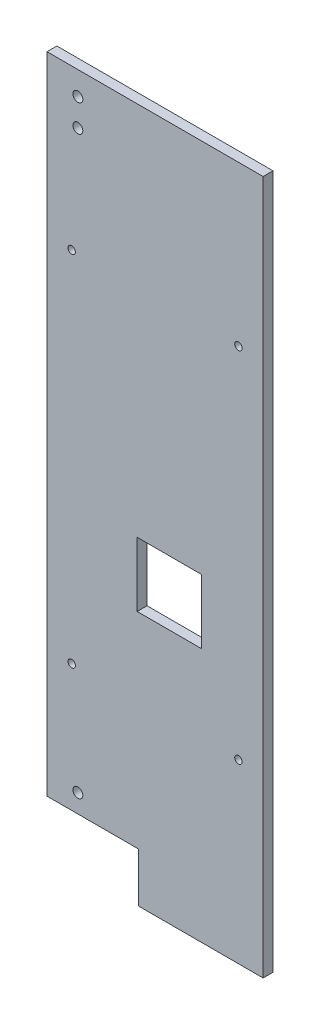
from build123d import *

# Parameters (mm, degrees)
ESQUISSE1_R      = 1.5
ESQUISSE1_R_2    = 2
ESQUISSE1_W      = 26
ESQUISSE1_H      = 26
EXTRUSION1_DEPTH = 4


with BuildPart() as part:
    # Esquisse1 → Extrusion1 (new body)
    with BuildSketch(Plane.XY):
        Polygon((-30.537686248, 34.180421053), (56.962313752, 34.180421053), (56.962313752, -246.819578947), (6.462313752, -246.819578947), (6.462313752, -226.819578947), (-30.537686248, -226.819578947), align=None)
        with Locations((-20.537686248, -175.319578947)):
            Circle(ESQUISSE1_R, mode=Mode.SUBTRACT)
        with Locations((-20.537686248, -30.319578947)):
            Circle(ESQUISSE1_R, mode=Mode.SUBTRACT)
        with Locations((46.962313752, -30.319578947)):
            Circle(ESQUISSE1_R, mode=Mode.SUBTRACT)
        with Locations((46.962313752, -175.319578947)):
            Circle(ESQUISSE1_R, mode=Mode.SUBTRACT)
        with Locations((-18.037686248, -219.319578947)):
            Circle(ESQUISSE1_R_2, mode=Mode.SUBTRACT)
        with Locations((-18.037686248, 24.680421053)):
            Circle(ESQUISSE1_R_2, mode=Mode.SUBTRACT)
        with Locations((-18.037686248, 13.680421053)):
            Circle(ESQUISSE1_R_2, mode=Mode.SUBTRACT)
        with Locations((18.962313752, -130.819578947)):
            Rectangle(ESQUISSE1_W, ESQUISSE1_H, mode=Mode.SUBTRACT)
    extrude(amount=EXTRUSION1_DEPTH)


solid = part.part
